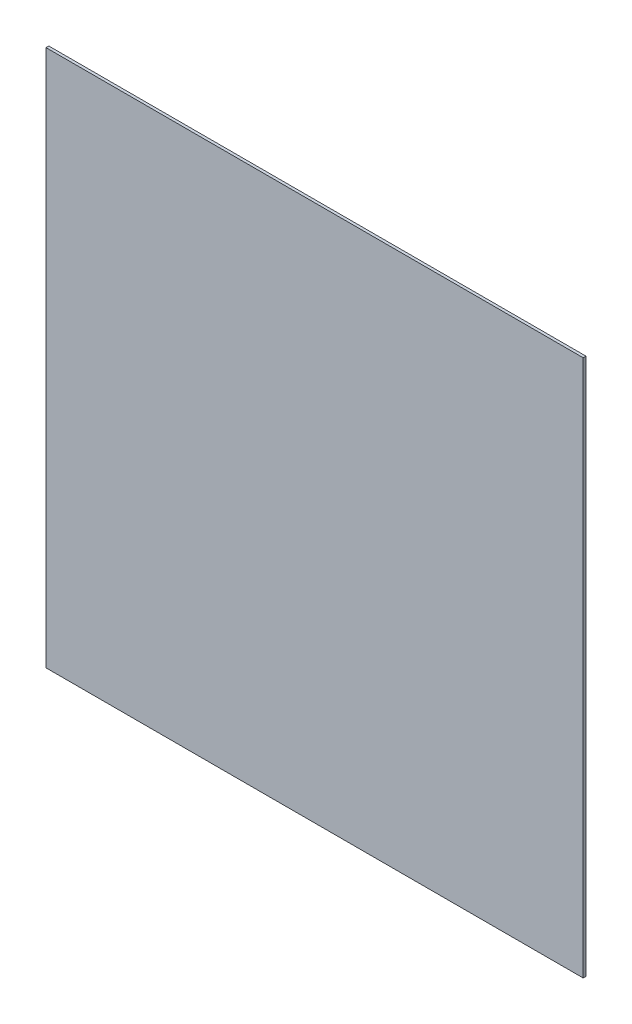
from build123d import *

# Parameters (mm, degrees)
SKETCH1_W           = 609.6
SKETCH1_H           = 609.6
BOSS_EXTRUDE1_DEPTH = 3.175


with BuildPart() as part:
    # Sketch1 → Boss-Extrude1 (new body)
    with BuildSketch(Plane.XY):
        with Locations((304.8, 304.8)):
            Rectangle(SKETCH1_W, SKETCH1_H)
    extrude(amount=BOSS_EXTRUDE1_DEPTH)


solid = part.part
